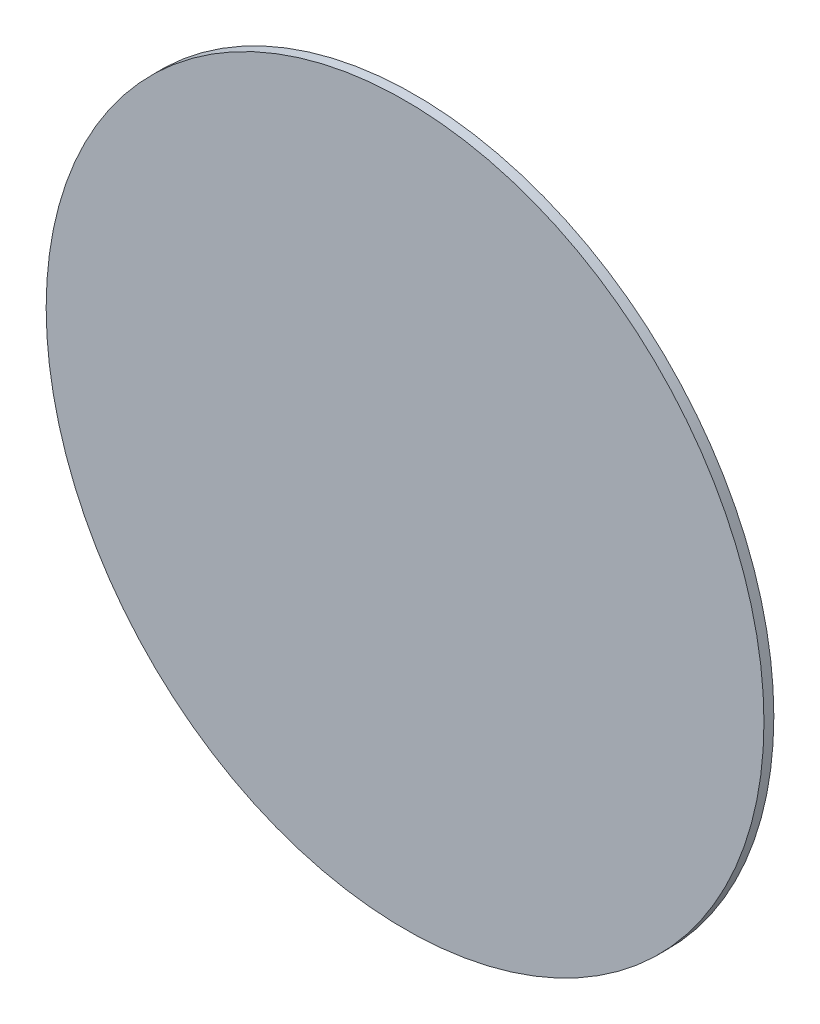
from build123d import *

# Parameters (mm, degrees)
ESQUISSE1_R        = 363.2
BOSS_EXTRU_1_DEPTH = 10


with BuildPart() as part:
    # Esquisse1 → Boss.-Extru.1 (new body)
    with BuildSketch(Plane.XY):
        Circle(ESQUISSE1_R)
    extrude(amount=BOSS_EXTRU_1_DEPTH)


solid = part.part
